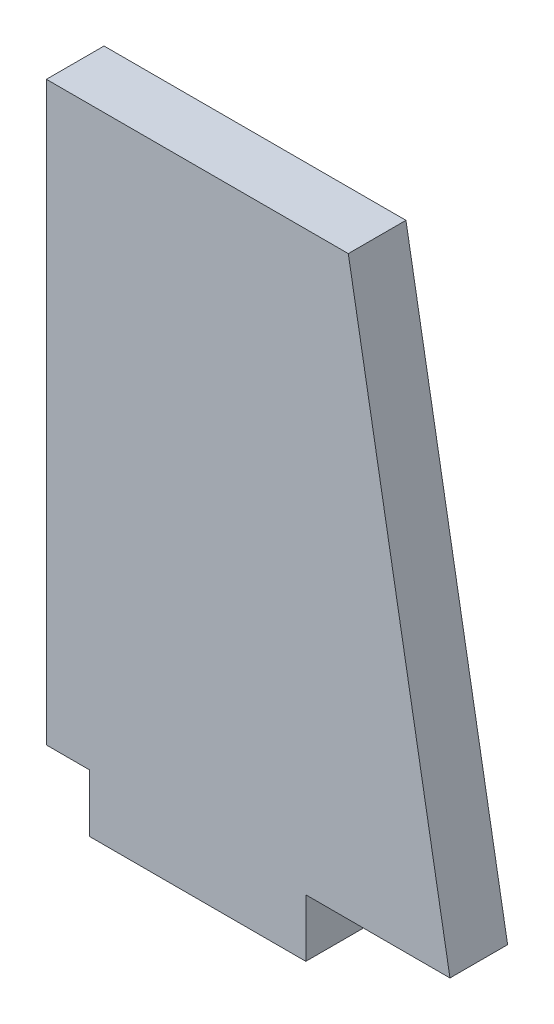
from build123d import *

# Parameters (mm, degrees)
BOSS_EXTRUDE1_DEPTH = 4


with BuildPart() as part:
    # Sketch1 → Boss-Extrude1 (new body)
    with BuildSketch(Plane.XY):
        Polygon((0, 0), (-7.053079228, 40), (-28, 40), (-28, 0), (-25, 0), (-25, -4), (-10, -4), (-10, 0), align=None)
    extrude(amount=BOSS_EXTRUDE1_DEPTH)


solid = part.part
